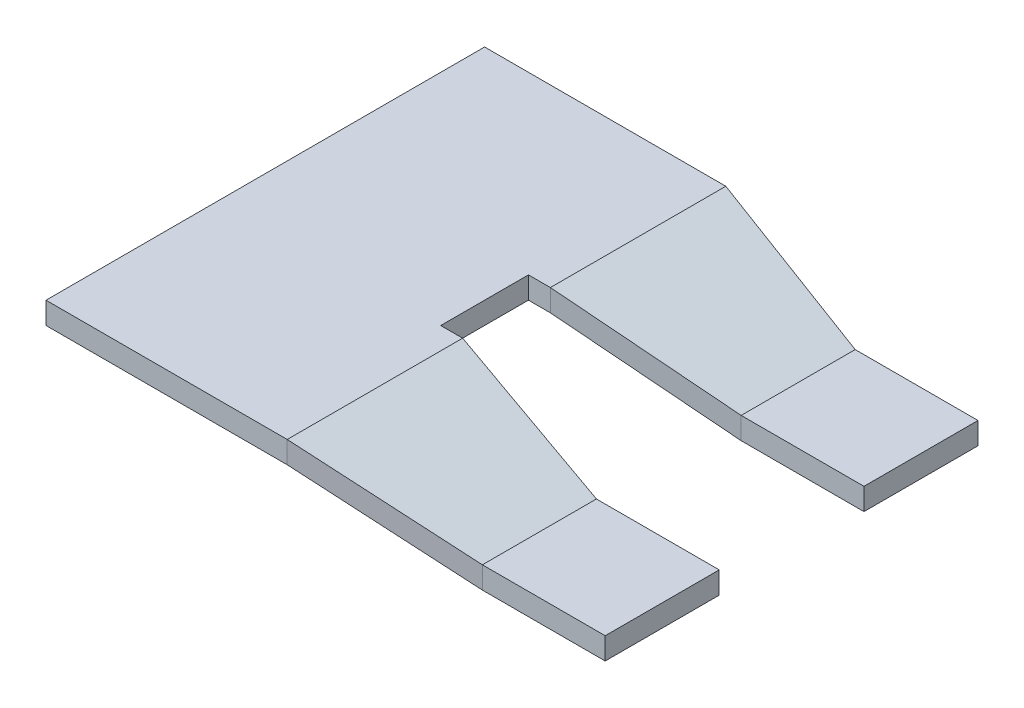
from build123d import *

# Parameters (mm, degrees)
SKETCH_1_W        = 28
SKETCH_1_H        = 26
EXTRUDE_1_DEPTH   = 5
EXTRUDE_1_2_DEPTH = 5
EXTRUDE_START     = 10
SKETCH_1_12_W     = 50
SKETCH_1_12_H     = 100
EXTRUDE_2_DEPTH   = 5
SKETCH_2_W        = 40
SKETCH_2_H        = 5
EXTRUDE_3_DEPTH   = 5


with BuildPart() as part:
    # 草图1 → 凸台-拉伸1 (new body)
    with BuildSketch(Plane(origin=(0, 0, 0), x_dir=(1, 0, 0), z_dir=(0, 1, 0))):
        with Locations((106, 29.5)):
            Rectangle(SKETCH_1_W, SKETCH_1_H)
    extrude(amount=EXTRUDE_1_DEPTH)


with BuildPart() as body_2:
    # 草图1 → Extrude 1 2 (new body)
    with BuildSketch(Plane(origin=(0, 0, 0), x_dir=(1, 0, 0), z_dir=(0, 1, 0))):
        with Locations((106, -29.5)):
            Rectangle(SKETCH_1_W, SKETCH_1_H)
    extrude(amount=EXTRUDE_1_2_DEPTH)


with BuildPart() as body_3:
    # 草图1<12> → 凸台-拉伸2 (new body)
    with BuildSketch(Plane(origin=(0, 0, 0), x_dir=(1, 0, 0), z_dir=(0, 1, 0)).offset(EXTRUDE_START)):
        with Locations((25, 0)):
            Rectangle(SKETCH_1_12_W, SKETCH_1_12_H)
    extrude(amount=EXTRUDE_2_DEPTH)

    # 草图2 → 凸台-拉伸3 (add)
    with BuildSketch(Plane(origin=(50, 0, 0), x_dir=(0, 0, -1), z_dir=(1, 0, 0))):
        with Locations((30, 12.5)):
            Rectangle(SKETCH_2_W, SKETCH_2_H)
        with Locations((-30, 12.5)):
            Rectangle(SKETCH_2_W, SKETCH_2_H)
    extrude(amount=EXTRUDE_3_DEPTH)


    add(body_2.part)  # loft_5 joins it to this body
    # loft from a face of the part (loft_5)
    loft([body_3.faces().sort_by_distance((55, 12.5, 30))[0], body_3.faces().sort_by_distance((92, 2.5, 29.5))[0]])


    add(part.part)  # loft_6 joins it to this body
    # loft from a face of the part (loft_6)
    loft([body_3.faces().sort_by_distance((55, 12.5, -30))[0], body_3.faces().sort_by_distance((92, 2.5, -29.5))[0]])


solid = body_3.part
